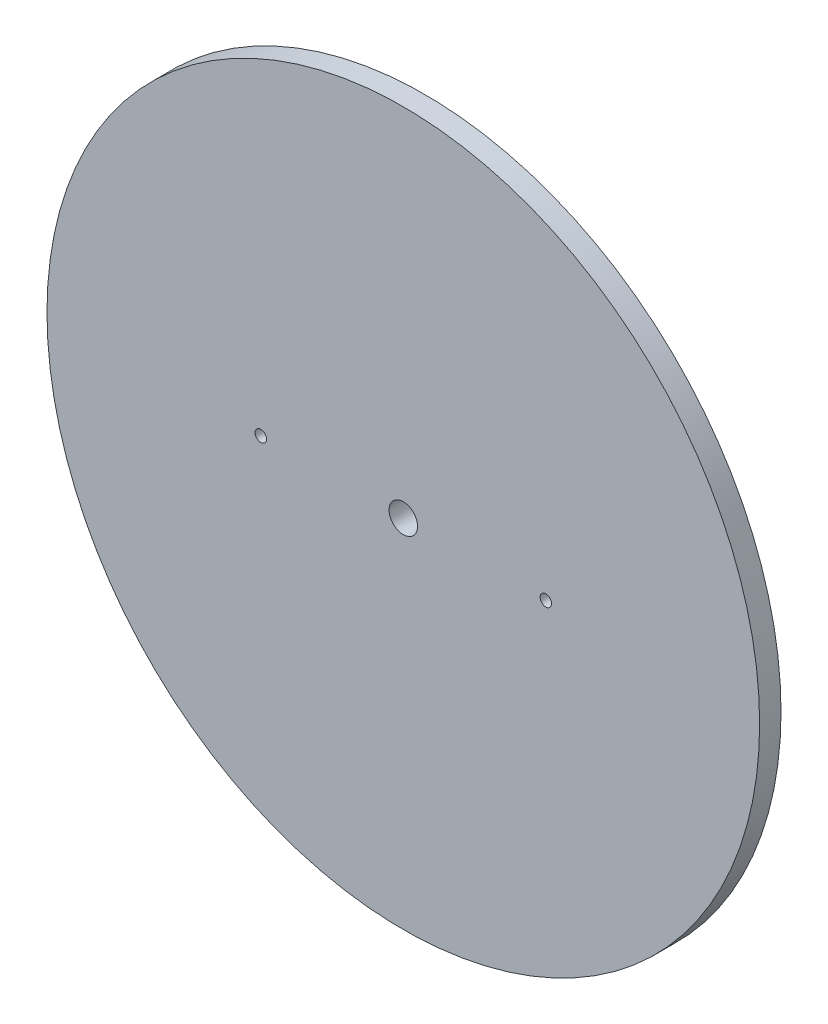
from build123d import *

# Parameters (mm, degrees)
SKETCH1_R           = 100
BOSS_EXTRUDE1_DEPTH = 6
SKETCH2_R           = 4
SKETCH2_R_2         = 1.6
CUT_EXTRUDE2_DEPTH  = 7


with BuildPart() as part:
    # Sketch1 → Boss-Extrude1 (new body)
    with BuildSketch(Plane.XY):
        Circle(SKETCH1_R)
    extrude(amount=BOSS_EXTRUDE1_DEPTH)

    # Sketch2 → Cut-Extrude2 (cut)
    with BuildSketch(Plane.XY):
        Circle(SKETCH2_R)
        with Locations((40, 0)):
            Circle(SKETCH2_R_2)
        with Locations((-40, 0)):
            Circle(SKETCH2_R_2)
    extrude(amount=CUT_EXTRUDE2_DEPTH, mode=Mode.SUBTRACT)


solid = part.part
